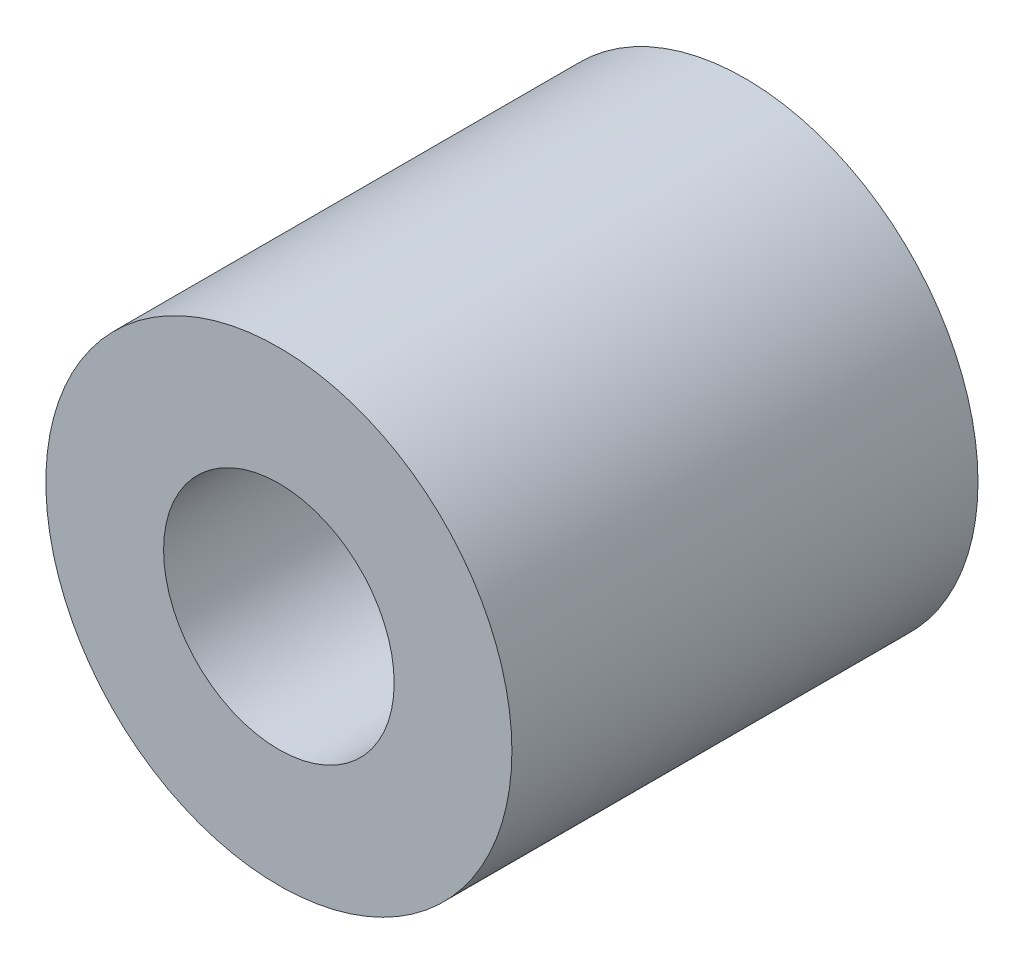
from build123d import *

# Parameters (mm, degrees)
SKETCH1_R           = 4.75
BOSS_EXTRUDE1_DEPTH = 4.75
SKETCH2_R           = 2.35
CUT_EXTRUDE1_DEPTH  = 12.635076278


with BuildPart() as part:
    # Sketch1 → Boss-Extrude1 (new, symmetric)
    with BuildSketch(Plane.XY):
        Circle(SKETCH1_R)
    extrude(amount=BOSS_EXTRUDE1_DEPTH, both=True)

    # Sketch2 → Cut-Extrude1 (cut, through all)
    with BuildSketch(Plane.XY.offset(4.75)):
        Circle(SKETCH2_R)
    extrude(amount=-CUT_EXTRUDE1_DEPTH, mode=Mode.SUBTRACT)


solid = part.part
